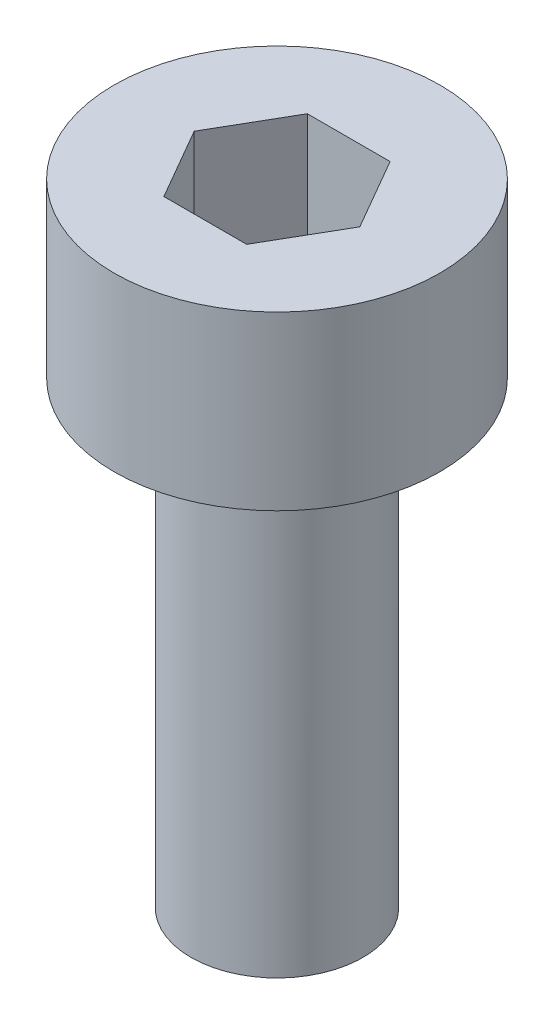
from build123d import *

# Parameters (mm, degrees)
SKETCH1_R           = 2.84
BOSS_EXTRUDE1_DEPTH = 3
SKETCH2_R           = 1.5
BOSS_EXTRUDE2_DEPTH = 8


with BuildPart() as part:
    # Sketch1 → Boss-Extrude1 (new body)
    with BuildSketch(Plane(origin=(0, 0, 0), x_dir=(1, 0, 0), z_dir=(0, 1, 0))):
        with Locations(Location((0, 0, 0), (0, 0, 270))):
            Circle(SKETCH1_R)
        Polygon((0.721687836, 1.25), (-0.721687836, 1.25), (-1.443375673, 0), (-0.721687836, -1.25), (0.721687836, -1.25), (1.443375673, 0), align=None, mode=Mode.SUBTRACT)
    extrude(amount=BOSS_EXTRUDE1_DEPTH)

    # Sketch2 → Boss-Extrude2 (add)
    with BuildSketch(Plane.XZ):
        with Locations(Location((0, 0, 0), (0, 0, 90))):
            Circle(SKETCH2_R)
    extrude(amount=BOSS_EXTRUDE2_DEPTH)


solid = part.part
